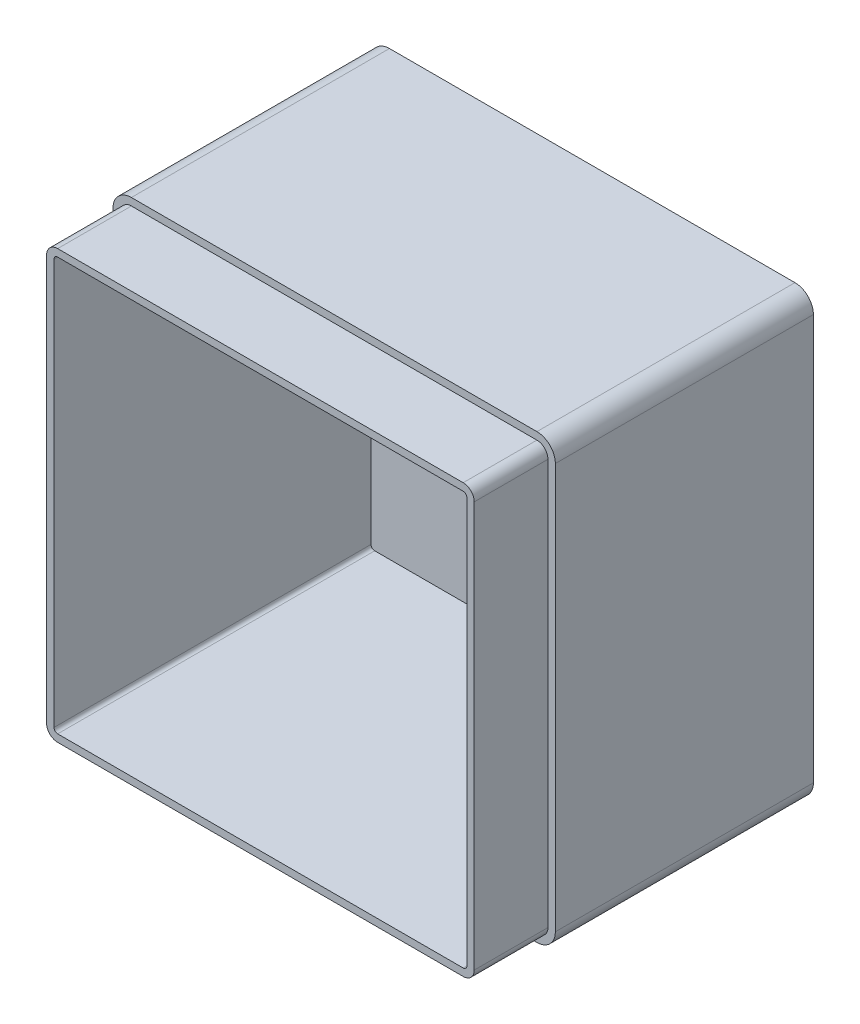
from build123d import *

# Parameters (mm, degrees)
SKETCH1_W           = 120
SKETCH1_H           = 120
BOSS_EXTRUDE1_DEPTH = 90
FILLET1_R           = 5
SHELL1_T            = -4
CUT_EXTRUDE1_DEPTH  = 20


with BuildPart() as part:
    # Sketch1 → Boss-Extrude1 (new body)
    with BuildSketch(Plane.XY):
        with Locations((60, 60)):
            Rectangle(SKETCH1_W, SKETCH1_H)
    extrude(amount=BOSS_EXTRUDE1_DEPTH)

    # Fillet1
    fillet1_edges = [part.edges().sort_by_distance(p)[0] for p in [
        (0, 120, 45),
        (120, 120, 45),
        (120, 0, 45),
        (0, 0, 45),
    ]]
    fillet(fillet1_edges, radius=FILLET1_R)

    # Shell1
    shell1_openings = [part.faces().sort_by_distance(p)[0] for p in [
        (60, 60, 90),
    ]]
    offset(amount=SHELL1_T, openings=shell1_openings, kind=Kind.INTERSECTION)

    # Sketch3 → Cut-Extrude1 (cut)
    with BuildSketch(Plane.XY.offset(90)):
        with BuildLine():
            Line((0, 115), (0, 5))
            ThreePointArc((0, 5), (1.464466094, 1.464466094), (5, 0))
            Line((5, 0), (115, 0))
            ThreePointArc((115, 0), (118.535533906, 1.464466094), (120, 5))
            Line((120, 5), (120, 115))
            ThreePointArc((120, 115), (118.535533906, 118.535533906), (115, 120))
            Line((115, 120), (5, 120))
            ThreePointArc((5, 120), (1.464466094, 118.535533906), (0, 115))
        make_face()
        with BuildLine():
            Line((2, 115), (2, 5))
            ThreePointArc((2, 5), (2.878679656, 2.878679656), (5, 2))
            Line((5, 2), (115, 2))
            ThreePointArc((115, 2), (117.121320344, 2.878679656), (118, 5))
            Line((118, 5), (118, 115))
            ThreePointArc((118, 115), (117.121320344, 117.121320344), (115, 118))
            Line((115, 118), (5, 118))
            ThreePointArc((5, 118), (2.878679656, 117.121320344), (2, 115))
        make_face(mode=Mode.SUBTRACT)
    extrude(amount=-CUT_EXTRUDE1_DEPTH, mode=Mode.SUBTRACT)


solid = part.part
